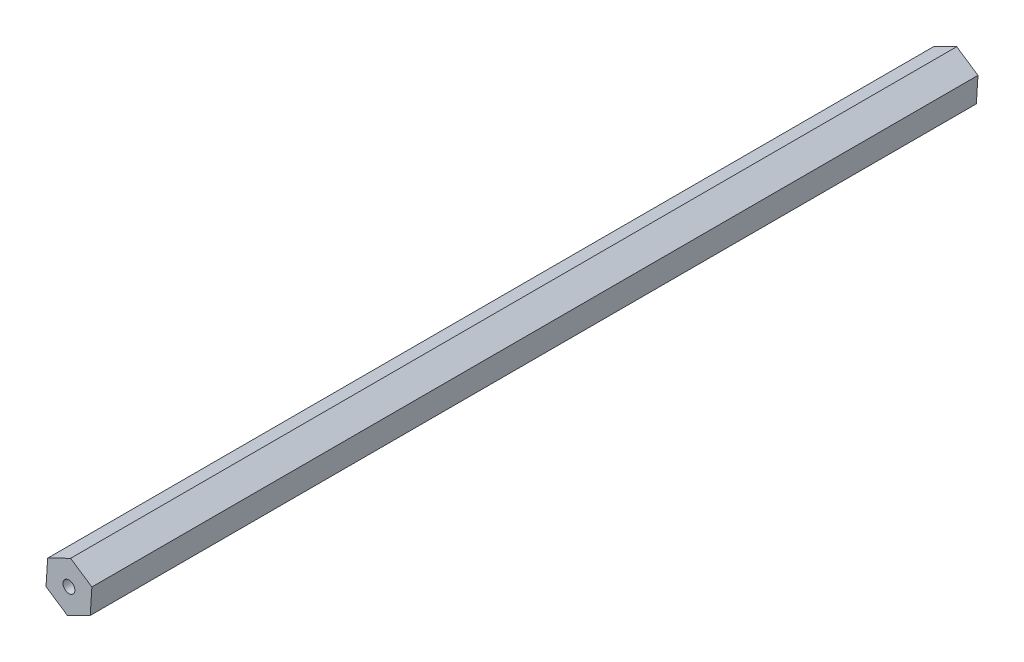
from build123d import *

# Parameters (mm, degrees)
SKETCH1_R           = 2
BOSS_EXTRUDE1_DEPTH = 300


with BuildPart() as part:
    # Sketch1 → Boss-Extrude1 (new body)
    with BuildSketch(Plane.XY):
        Polygon((7.202784052, -4.808315911), (7.765515754, 3.833636012), (0.562731702, 8.641951923), (-7.202784052, 4.808315911), (-7.765515754, -3.833636012), (-0.562731702, -8.641951923), align=None)
        Circle(SKETCH1_R, mode=Mode.SUBTRACT)
    extrude(amount=BOSS_EXTRUDE1_DEPTH)


solid = part.part
